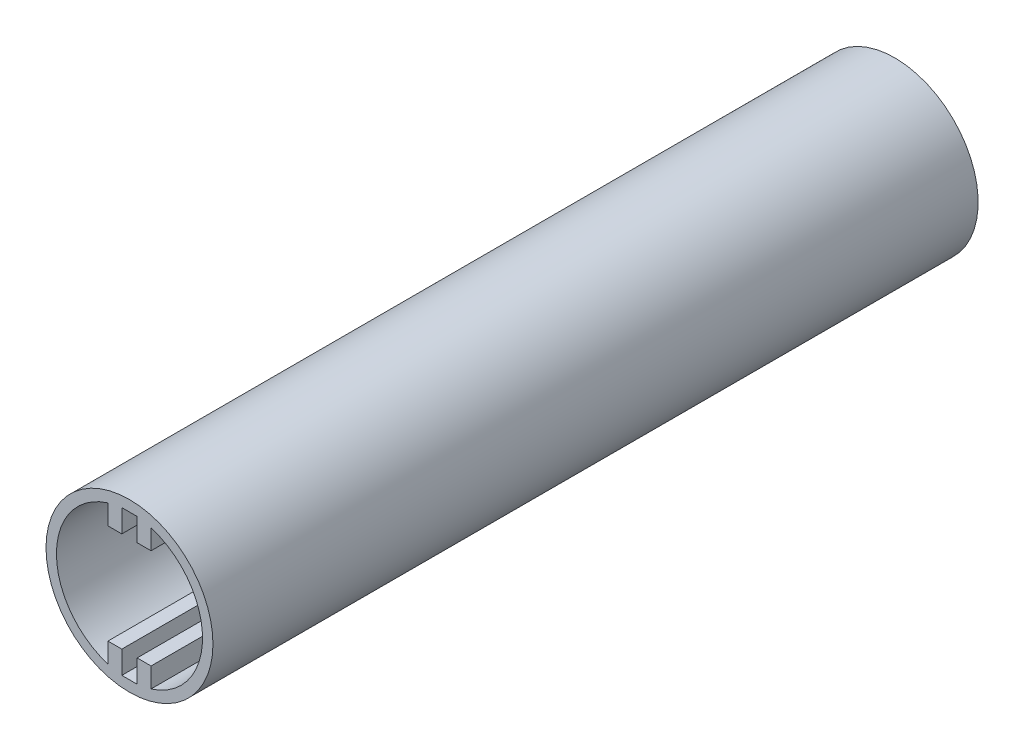
from build123d import *

# Parameters (mm, degrees)
SKETCH1_R           = 6
BOSS_EXTRUDE1_DEPTH = 17.5
SKETCH2_R           = 6
SKETCH2_R_2         = 5.25
BOSS_EXTRUDE2_DEPTH = 20


with BuildPart() as part:
    # Sketch1 → Boss-Extrude1 (new, symmetric)
    with BuildSketch(Plane.XY):
        Circle(SKETCH1_R)
        with BuildLine():
            Line((1.55, -5.015974482), (1.55, -3.585195962))
            Line((1.55, -3.585195962), (0.55, -3.585195962))
            Line((0.55, -3.585195962), (0.55, -5.221110993))
            Line((0.55, -5.221110993), (-0.55, -5.221110993))
            Line((-0.55, -5.221110993), (-0.55, -3.585195962))
            Line((-0.55, -3.585195962), (-1.55, -3.585195962))
            Line((-1.55, -3.585195962), (-1.55, -5.015974482))
            ThreePointArc((-1.55, -5.015974482), (-5.25, 0), (-1.55, 5.015974482))
            Line((-1.55, 5.015974482), (-1.55, 3.585195962))
            Line((-1.55, 3.585195962), (-0.55, 3.585195962))
            Line((-0.55, 3.585195962), (-0.55, 5.221110993))
            Line((-0.55, 5.221110993), (0.55, 5.221110993))
            Line((0.55, 5.221110993), (0.55, 3.585195962))
            Line((0.55, 3.585195962), (1.55, 3.585195962))
            Line((1.55, 3.585195962), (1.55, 5.015974482))
            ThreePointArc((1.55, 5.015974482), (5.25, 0), (1.55, -5.015974482))
        make_face(mode=Mode.SUBTRACT)
    extrude(amount=BOSS_EXTRUDE1_DEPTH, both=True)

    # Sketch2 → Boss-Extrude2 (add)
    with BuildSketch(Plane(origin=(0, 0, -17.5), x_dir=(-1, 0, 0), z_dir=(0, 0, -1))):
        Circle(SKETCH2_R)
        Circle(SKETCH2_R_2, mode=Mode.SUBTRACT)
    extrude(amount=BOSS_EXTRUDE2_DEPTH)


solid = part.part
